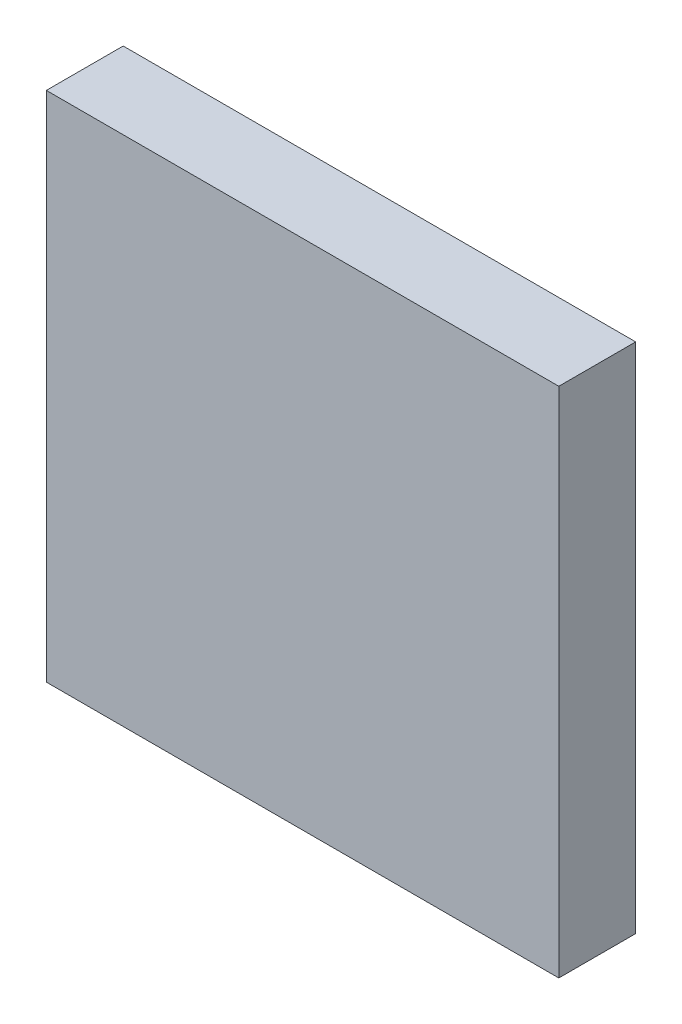
from build123d import *

# Parameters (mm, degrees)
SKETCH_1_W      = 40
SKETCH_1_H      = 40
EXTRUDE_1_DEPTH = 6


with BuildPart() as part:
    # 草图1 → 凸台-拉伸1 (new body)
    with BuildSketch(Plane.XY):
        with Locations((20, 20)):
            Rectangle(SKETCH_1_W, SKETCH_1_H)
    extrude(amount=EXTRUDE_1_DEPTH)


solid = part.part
